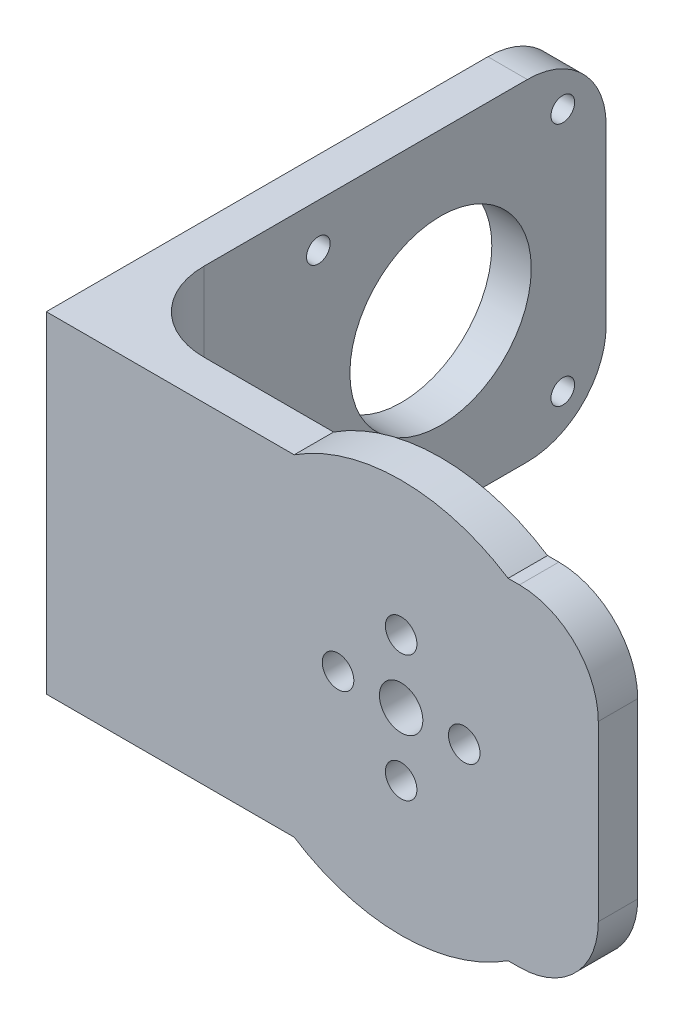
from build123d import *

# Parameters (mm, degrees)
EXTRUDE_1_DEPTH     = 5
SKETCH_2_W          = 5
SKETCH_2_H          = 42
EXTRUDE_2_DEPTH     = 66
SKETCH_3_R          = 11.5
SKETCH_3_R_2        = 1.5
CUT_EXTRUDE_1_DEPTH = 5
SKETCH_5_R          = 2
SKETCH_5_R_2        = 2.75
CUT_EXTRUDE_2_DEPTH = 80.818544211
FILLET_1_R          = 10
FILLET_2_R          = 10


with BuildPart() as part:
    # 草图1 → 凸台-拉伸1 (new body)
    with BuildSketch(Plane.XY):
        with BuildLine():
            Line((13.564659966, -21), (25, -21))
            Line((25, -21), (25, 21))
            Line((25, 21), (13.564659966, 21))
            ThreePointArc((13.564659966, 21), (0, 25), (-13.564659966, 21))
            Line((-13.564659966, 21), (-40, 21))
            Line((-40, 21), (-40, -21))
            Line((-40, -21), (-13.564659966, -21))
            ThreePointArc((-13.564659966, -21), (0, -25), (13.564659966, -21))
        make_face()
    extrude(amount=EXTRUDE_1_DEPTH)

    # 草图2 → 凸台-拉伸2 (add)
    with BuildSketch(Plane.XY.offset(5)):
        with Locations((-42.5, 0)):
            Rectangle(SKETCH_2_W, SKETCH_2_H)
    extrude(amount=-EXTRUDE_2_DEPTH)

    # 草图3 → 切除-拉伸1 (cut)
    with BuildSketch(Plane.ZY.offset(45)):
        with Locations((-40, 0)):
            Circle(SKETCH_3_R)
        with Locations((-55.5, 15.5)):
            Circle(SKETCH_3_R_2)
        with Locations((-55.5, -15.5)):
            Circle(SKETCH_3_R_2)
        with Locations((-24.5, 15.5)):
            Circle(SKETCH_3_R_2)
        with Locations((-24.5, -15.5)):
            Circle(SKETCH_3_R_2)
        with Locations((34.5, 74.5)):
            Circle(SKETCH_3_R_2)
    extrude(amount=-CUT_EXTRUDE_1_DEPTH, mode=Mode.SUBTRACT)

    # 草图5 → 切除-拉伸2 (cut, through all)
    with BuildSketch(Plane(origin=(0, 0, 0), x_dir=(-1, 0, 0), z_dir=(0, 0, -1))):
        with Locations((0, 8)):
            Circle(SKETCH_5_R)
        with Locations((8, 0)):
            Circle(SKETCH_5_R)
        with Locations((0, -8)):
            Circle(SKETCH_5_R)
        with Locations((-8, 0)):
            Circle(SKETCH_5_R)
        Circle(SKETCH_5_R_2)
    extrude(amount=-CUT_EXTRUDE_2_DEPTH, mode=Mode.SUBTRACT)

    # 圆角1
    fillet_1_edges = [part.edges().sort_by_distance(p)[0] for p in [
        (-40, 0, 0),
    ]]
    fillet(fillet_1_edges, radius=FILLET_1_R)

    # 圆角2
    fillet_2_edges = [part.edges().sort_by_distance(p)[0] for p in [
        (25, -21, 2.5),
        (25, 21, 2.5),
        (-42.5, 21, -61),
        (-42.5, -21, -61),
    ]]
    fillet(fillet_2_edges, radius=FILLET_2_R)


solid = part.part
